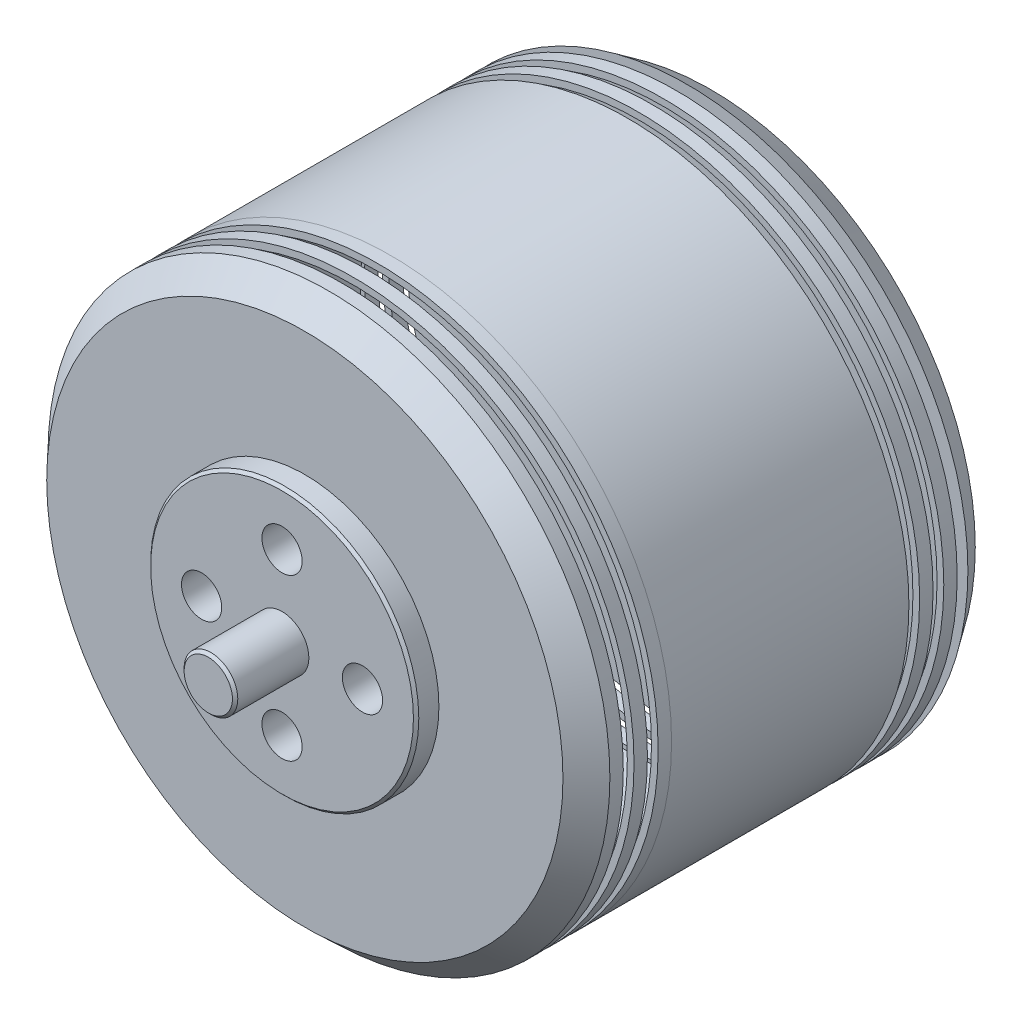
from build123d import *

# Parameters (mm, degrees)
SKETCH_2_R          = 20.95
SKETCH_1_R          = 19.7
SKETCH_3_R          = 20.95
SKETCH_3_R_2        = 20.45
EXTRUDE_1_DEPTH     = 1
SKETCH_4_R          = 20.95
SKETCH_4_R_2        = 20.45
EXTRUDE_2_DEPTH     = 1
SKETCH_5_R          = 20.95
SKETCH_5_R_2        = 19.95
EXTRUDE_3_DEPTH     = 17.7
SKETCH_6_R          = 20.95
SKETCH_6_R_2        = 20.45
EXTRUDE_4_DEPTH     = 1
SKETCH_7_R          = 20.95
SKETCH_7_R_2        = 20.45
EXTRUDE_5_DEPTH     = 1
SKETCH_8_R          = 20.95
SKETCH_8_R_2        = 20.45
EXTRUDE_6_DEPTH     = 1
SKETCH_10_R         = 20.95
SKETCH_9_R          = 19.25
SKETCH_11_R         = 10
EXTRUDE_7_DEPTH     = 1.7
SKETCH_12_R         = 2
EXTRUDE_8_DEPTH     = 5.5
MM_1_AT_2_COUNT     = 2
MM_1_AT_2_PITCH     = 12
MM_1_AT_3_COUNT     = 2
MM_1_AT_3_PITCH     = 8.485281374
MM_1_AT_4_COUNT     = 2
MM_1_AT_4_PITCH     = 8.485281374
SKETCH_15_R         = 6.9
CUT_EXTRUDE_1_DEPTH = 5.5
EXTRUDE_START       = -1
SKETCH_16_R         = 6.9
EXTRUDE_9_DEPTH     = 1
SKETCH_17_R         = 4.5
EXTRUDE_10_DEPTH    = 0.8
SKETCH_18_R         = 4.5
EXTRUDE_11_DEPTH    = 2
MM_2_AT_2_COUNT     = 2
MM_2_AT_2_PITCH     = 17.67766953
MM_2_AT_3_COUNT     = 2
MM_2_AT_3_PITCH     = 17.67766953
MM_2_AT_4_COUNT     = 2
MM_2_AT_4_PITCH     = 25
CHAMFER_1_SIZE      = 0.2


with BuildPart() as part:
    # 草图2 → 放样1 section 0
    with BuildSketch(Plane.XY.offset(1.8)):
        Circle(SKETCH_2_R)
    # 草图1 → 放样1 section 1
    with BuildSketch(Plane.XY):
        Circle(SKETCH_1_R)
    loft()

    # 草图15 → 切除-拉伸1 (cut)
    with BuildSketch(Plane(origin=(0, 0, 0), x_dir=(-1, 0, 0), z_dir=(0, 0, -1))):
        Circle(SKETCH_15_R)
    extrude(amount=-CUT_EXTRUDE_1_DEPTH, mode=Mode.SUBTRACT)

    # 草图16 → 凸台-拉伸9 (add)
    with BuildSketch(Plane.XY.offset(1.8).offset(EXTRUDE_START)):
        with Locations(Location((0, 0, 0), (0, 0, 180))):
            Circle(SKETCH_16_R)
    extrude(amount=EXTRUDE_9_DEPTH)

    # 草图17 → 凸台-拉伸10 (add)
    with BuildSketch(Plane(origin=(0, 0, 0.8), x_dir=(-1, 0, 0), z_dir=(0, 0, -1))):
        with Locations(Location((0, 0, 0), (0, 0, 180))):
            Circle(SKETCH_17_R)
    extrude(amount=EXTRUDE_10_DEPTH)

    # 草图18 → 凸台-拉伸11 (add)
    with BuildSketch(Plane(origin=(0, 0, 0), x_dir=(-1, 0, 0), z_dir=(0, 0, -1))):
        with Locations(Location((0, 0, 0), (0, 0, 180))):
            Circle(SKETCH_18_R)
    extrude(amount=EXTRUDE_11_DEPTH)

    # 草图20 → 大小mm 暗销孔2 (revolve, cut)
    with BuildSketch(Plane.YZ.offset(12.5)):
        Polygon((0, 0), (0, 5.901290929), (1.5, 5), (1.5, 0), align=None)
    mm_2 = revolve(axis=Axis((12.5, 0, -6.35), (0, 0, 1)), mode=Mode.SUBTRACT)

    # 大小mm 暗销孔2 at 2: 大小mm 暗销孔2 ×2
    with Locations(*[Vector(-0.7071067811865476, 0.7071067811865476, 0) * (i * MM_2_AT_2_PITCH) for i in range(1, MM_2_AT_2_COUNT)]):
        add(mm_2, mode=Mode.SUBTRACT)

    # 大小mm 暗销孔2 at 3: 大小mm 暗销孔2 ×2
    with Locations(*[Vector(-0.7071067811865476, -0.7071067811865476, 0) * (i * MM_2_AT_3_PITCH) for i in range(1, MM_2_AT_3_COUNT)]):
        add(mm_2, mode=Mode.SUBTRACT)

    # 大小mm 暗销孔2 at 4: 大小mm 暗销孔2 ×2
    with Locations(*[(-i * MM_2_AT_4_PITCH, 0, 0) for i in range(1, MM_2_AT_4_COUNT)]):
        add(mm_2, mode=Mode.SUBTRACT)


with BuildPart() as body_2:
    # 草图3 → 凸台-拉伸1 (new body)
    with BuildSketch(Plane.XY.offset(2.6)):
        Circle(SKETCH_3_R)
        Circle(SKETCH_3_R_2, mode=Mode.SUBTRACT)
    extrude(amount=EXTRUDE_1_DEPTH)


with BuildPart() as body_3:
    # 草图4 → 凸台-拉伸2 (new body)
    with BuildSketch(Plane.XY.offset(4.4)):
        Circle(SKETCH_4_R)
        Circle(SKETCH_4_R_2, mode=Mode.SUBTRACT)
    extrude(amount=EXTRUDE_2_DEPTH)


with BuildPart() as body_4:
    # 草图5 → 凸台-拉伸3 (new body)
    with BuildSketch(Plane.XY.offset(6.2)):
        Circle(SKETCH_5_R)
        Circle(SKETCH_5_R_2, mode=Mode.SUBTRACT)
    extrude(amount=EXTRUDE_3_DEPTH)


with BuildPart() as body_5:
    # 草图6 → 凸台-拉伸4 (new body)
    with BuildSketch(Plane.XY.offset(23.9)):
        Circle(SKETCH_6_R)
        Circle(SKETCH_6_R_2, mode=Mode.SUBTRACT)
    extrude(amount=EXTRUDE_4_DEPTH)


with BuildPart() as body_6:
    # 草图7 → 凸台-拉伸5 (new body)
    with BuildSketch(Plane.XY.offset(25.7)):
        Circle(SKETCH_7_R)
        Circle(SKETCH_7_R_2, mode=Mode.SUBTRACT)
    extrude(amount=EXTRUDE_5_DEPTH)


with BuildPart() as body_7:
    # 草图8 → 凸台-拉伸6 (new body)
    with BuildSketch(Plane.XY.offset(27.5)):
        Circle(SKETCH_8_R)
        Circle(SKETCH_8_R_2, mode=Mode.SUBTRACT)
    extrude(amount=EXTRUDE_6_DEPTH)

    # 草图10 → 放样2 section 0
    with BuildSketch(Plane.XY.offset(28.5)):
        Circle(SKETCH_10_R)
    # 草图9 → 放样2 section 1
    with BuildSketch(Plane.XY.offset(30.3)):
        Circle(SKETCH_9_R)
    loft()

    # 草图11 → 凸台-拉伸7 (add)
    with BuildSketch(Plane.XY.offset(30.3)):
        Circle(SKETCH_11_R)
    extrude(amount=EXTRUDE_7_DEPTH)

    # 草图12 → 凸台-拉伸8 (add)
    with BuildSketch(Plane.XY.offset(32)):
        Circle(SKETCH_12_R)
    extrude(amount=EXTRUDE_8_DEPTH)

    # 草图14 → 大小mm 暗销孔1 (revolve, cut)
    with BuildSketch(Plane(origin=(-6, 0, 32), x_dir=(0, -1, 0), z_dir=(1, 0, 0))):
        Polygon((0, 0), (0, 5.901290929), (1.5, 5), (1.5, 0), align=None)
    mm_1 = revolve(axis=Axis((-6, 0, 38.35), (0, 0, -1)), mode=Mode.SUBTRACT)

    # 大小mm 暗销孔1 at 2: 大小mm 暗销孔1 ×2
    with Locations(*[(i * MM_1_AT_2_PITCH, 0, 0) for i in range(1, MM_1_AT_2_COUNT)]):
        add(mm_1, mode=Mode.SUBTRACT)

    # 大小mm 暗销孔1 at 3: 大小mm 暗销孔1 ×2
    with Locations(*[Vector(0.7071067811865476, -0.7071067811865476, 0) * (i * MM_1_AT_3_PITCH) for i in range(1, MM_1_AT_3_COUNT)]):
        add(mm_1, mode=Mode.SUBTRACT)

    # 大小mm 暗销孔1 at 4: 大小mm 暗销孔1 ×2
    with Locations(*[Vector(0.7071067811865476, 0.7071067811865476, 0) * (i * MM_1_AT_4_PITCH) for i in range(1, MM_1_AT_4_COUNT)]):
        add(mm_1, mode=Mode.SUBTRACT)

    # 倒角1
    chamfer_1_edges = [body_7.edges().sort_by_distance(p)[0] for p in [
        (-10, 0, 32),
        (-2, 0, 37.5),
    ]]
    chamfer(chamfer_1_edges, length=CHAMFER_1_SIZE)


solid = Compound([part.part, body_2.part, body_3.part, body_4.part, body_5.part, body_6.part, body_7.part])
